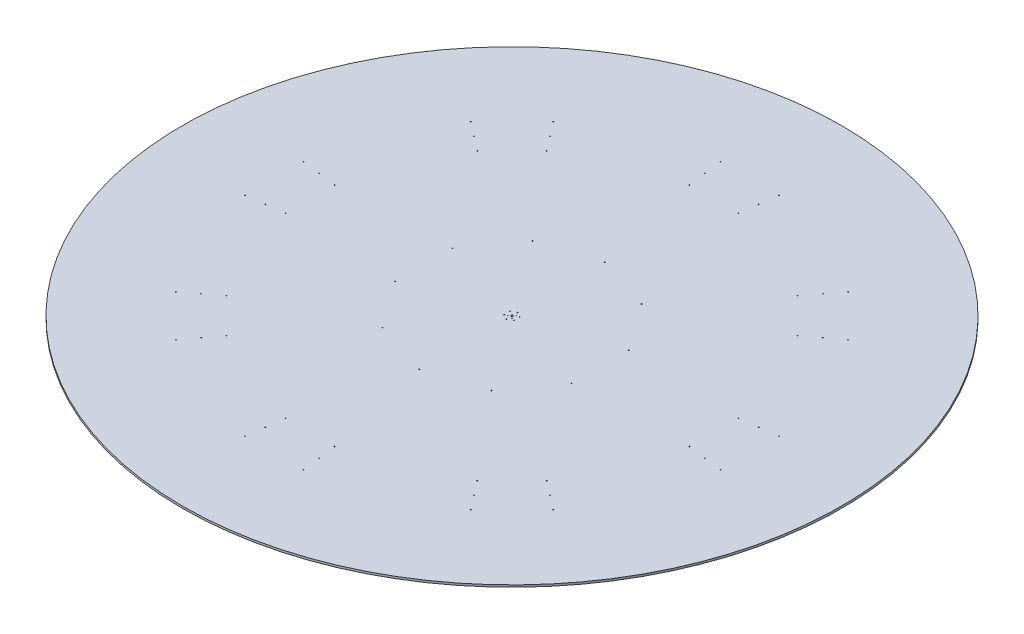
from build123d import *

# Parameters (mm, degrees)
SKETCH_1_W               = 1595
SKETCH_1_H               = 10
HOLE_WIZARD_M51_D        = 4.2
HOLE_WIZARD_M52_D        = 4.2
PATTERN_CIRCULAR_1_COUNT = 8
HOLE_WIZARD_M2_51_D      = 2.05
HOLE_WIZARD_M54_D        = 4.2
HOLE_WIZARD_M54_DEPTH    = 5
HOLE_WIZARD_M54_TIP      = 1.2618073


with BuildPart() as part:
    # Эскиз1 → Повернуть1 (revolve)
    with BuildSketch(Plane(origin=(0, 0, 0), x_dir=(0, 0, -1), z_dir=(1, 0, 0)), mode=Mode.PRIVATE) as revolve_1_sk:
        with Locations((802.5, 5)):
            Rectangle(SKETCH_1_W, SKETCH_1_H)
    revolve(revolve_1_sk.sketch.rotate(Axis((0, 18.050059897, 0), (0, -1, 0)), 180), axis=Axis((0, 18.050059897, 0), (0, -1, 0)))

    # Отверстие обработанное метчиком M51 (through all)
    with Locations(Plane(origin=(0, 0, 450), x_dir=(0, 0, -1), z_dir=(0, -1, 0))):
        with Locations((0, 0), (85.942352531, 264.503363532), (310.942352531, 427.975432333), (589.057647469, 427.975432333), (814.057647469, 264.503363532), (900, 0), (814.057647469, -264.503363532), (589.057647469, -427.975432333), (310.942352531, -427.975432333), (85.942352531, -264.503363532)):
            Hole(HOLE_WIZARD_M51_D / 2)

    # Отверстие обработанное метчиком M52 (through all)
    with Locations(Plane(origin=(0, 10, 0), x_dir=(1, 0, 0), z_dir=(0, 1, 0))):
        with Locations((-118.980166204, -980.357062529), (-130.401208023, -1067.108487899), (-141.822249842, -1153.859913269), (-609.085444549, -777.348809248), (-662.352069587, -846.767226523), (-715.618694626, -916.185643798)):
            hole_wizard_m52 = Hole(HOLE_WIZARD_M52_D / 2)

    # Круговой массив1: Отверстие обработанное метчиком M52 ×8 about axis
    pattern_circular_1_axis = Axis((0, 0, 0), (0, 1, 0))
    for i in range(1, PATTERN_CIRCULAR_1_COUNT):
        add(hole_wizard_m52.rotate(pattern_circular_1_axis, i * 360 / PATTERN_CIRCULAR_1_COUNT), mode=Mode.SUBTRACT)

    # Отверстие обработанное метчиком M2.51 (through all)
    with Locations(Plane(origin=(0, 0, 0), x_dir=(-1, 0, 0), z_dir=(0, -1, 0))):
        with Locations((10, -10), (-10, -10), (-10, 10), (10, 10)):
            Hole(HOLE_WIZARD_M2_51_D / 2)

    # Отверстие обработанное метчиком M54
    with Locations(Plane(origin=(0, 10, 0), x_dir=(1, 0, 0), z_dir=(0, 1, 0))):
        with Locations((0, 27.5), (-23.815698604, 13.75), (23.815698604, 13.75), (23.815698604, -13.75), (0, -27.5), (-23.815698604, -13.75)):
            Hole(HOLE_WIZARD_M54_D / 2, depth=HOLE_WIZARD_M54_DEPTH)
            with Locations((0, 0, -(HOLE_WIZARD_M54_DEPTH + HOLE_WIZARD_M54_TIP / 2))):  # 118° drill point
                Cone(0, HOLE_WIZARD_M54_D / 2, HOLE_WIZARD_M54_TIP, mode=Mode.SUBTRACT)


solid = part.part
